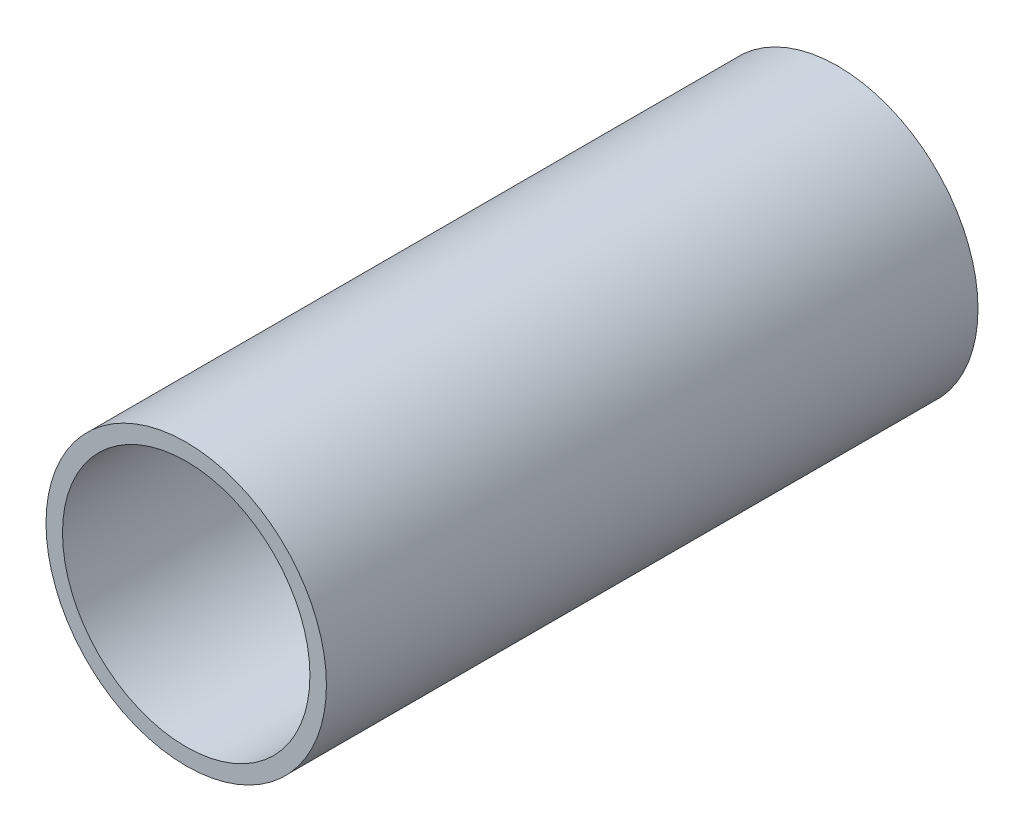
from build123d import *

# Parameters (mm, degrees)
SKETCH1_R           = 85
SKETCH1_R_2         = 75
BOSS_EXTRUDE1_DEPTH = 395


with BuildPart() as part:
    # Sketch1 → Boss-Extrude1 (new body)
    with BuildSketch(Plane.XY):
        with Locations(Location((0, 0, 0), (0, 0, 180))):
            Circle(SKETCH1_R)
        with Locations(Location((0, 0, 0), (0, 0, 180))):
            Circle(SKETCH1_R_2, mode=Mode.SUBTRACT)
    extrude(amount=BOSS_EXTRUDE1_DEPTH)


solid = part.part
